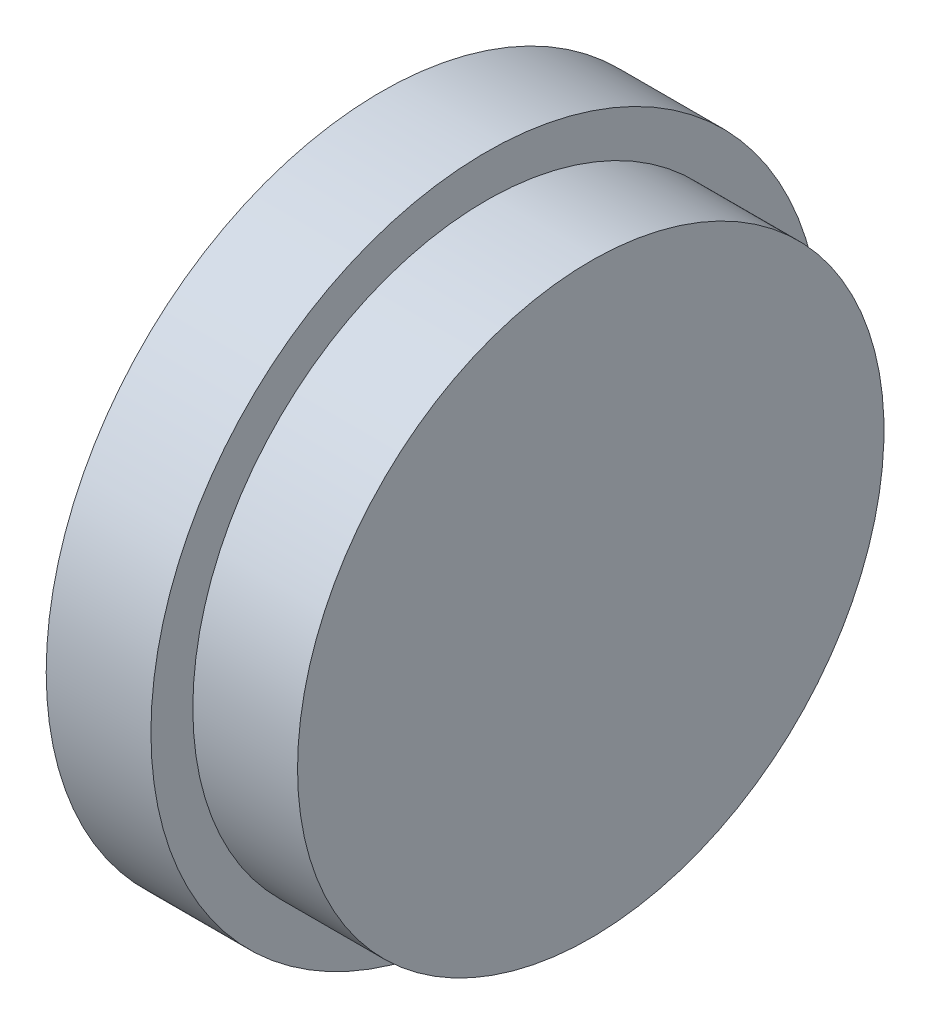
from build123d import *


with BuildPart() as part:
    # Эскиз1 → Повернуть1 (revolve)
    with BuildSketch(Plane.XY, mode=Mode.PRIVATE) as revolve_1_sk:
        Polygon((0, 0), (0, 8), (2.5, 8), (2.5, 7), (5, 7), (5, 0), align=None)
    revolve(revolve_1_sk.sketch.rotate(Axis((0, 0, 0), (1, 0, 0)), 90), axis=Axis((0, 0, 0), (1, 0, 0)))


solid = part.part
